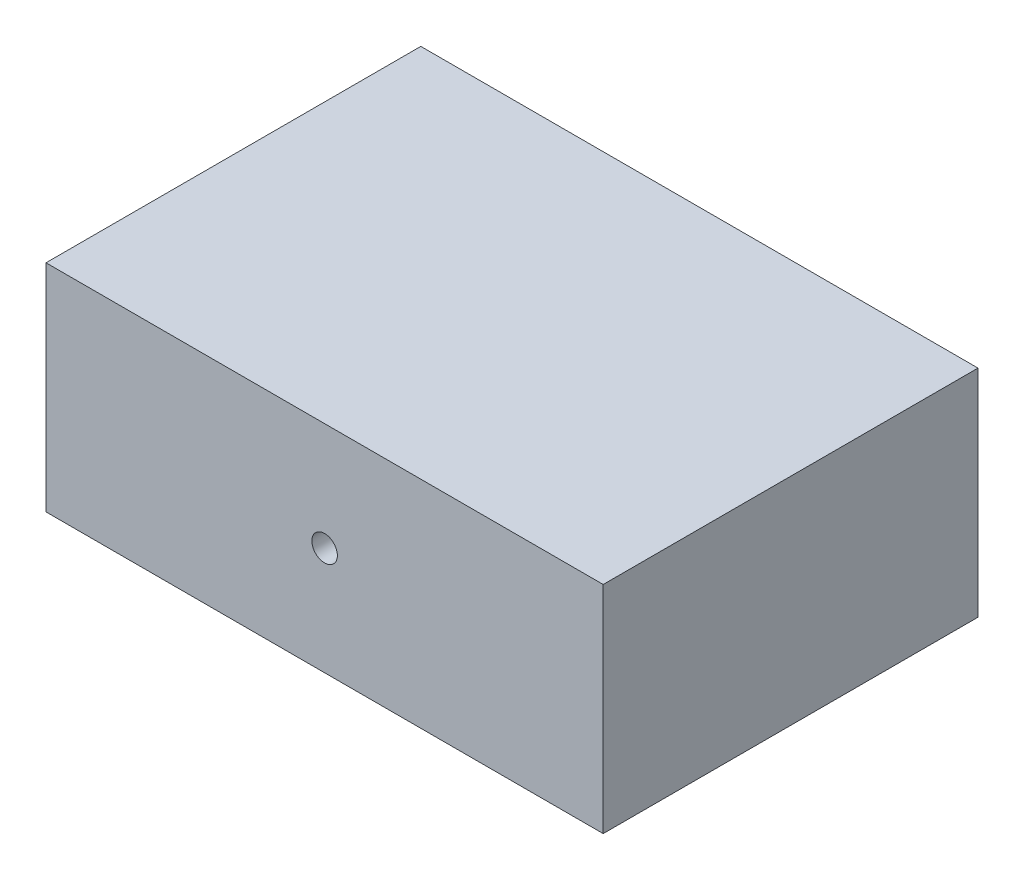
from build123d import *

# Parameters (mm, degrees)
SKETCH1_W                   = 111.506
SKETCH1_H                   = 75.0062
BOSS_EXTRUDE1_DEPTH         = 43.18
F_1_4_20_TAPPED_HOLE1_D     = 5.1054
F_1_4_20_TAPPED_HOLE1_DEPTH = 16.51
F_1_4_20_TAPPED_HOLE1_TIP   = 1.533816902


with BuildPart() as part:
    # Sketch1 → Boss-Extrude1 (new body)
    with BuildSketch(Plane(origin=(0, 0, 0), x_dir=(1, 0, 0), z_dir=(0, 1, 0))):
        with Locations((55.753, 37.5031)):
            Rectangle(SKETCH1_W, SKETCH1_H)
    extrude(amount=BOSS_EXTRUDE1_DEPTH)

    # 1/4-20 Tapped Hole1
    with Locations(Plane(origin=(55.753, 21.59, 0), x_dir=(1, 0, 0), z_dir=(0, 0, 1))):
        with Locations((0, 0)):
            Hole(F_1_4_20_TAPPED_HOLE1_D / 2, depth=F_1_4_20_TAPPED_HOLE1_DEPTH)
            with Locations((0, 0, -(F_1_4_20_TAPPED_HOLE1_DEPTH + F_1_4_20_TAPPED_HOLE1_TIP / 2))):  # 118° drill point
                Cone(0, F_1_4_20_TAPPED_HOLE1_D / 2, F_1_4_20_TAPPED_HOLE1_TIP, mode=Mode.SUBTRACT)


solid = part.part
